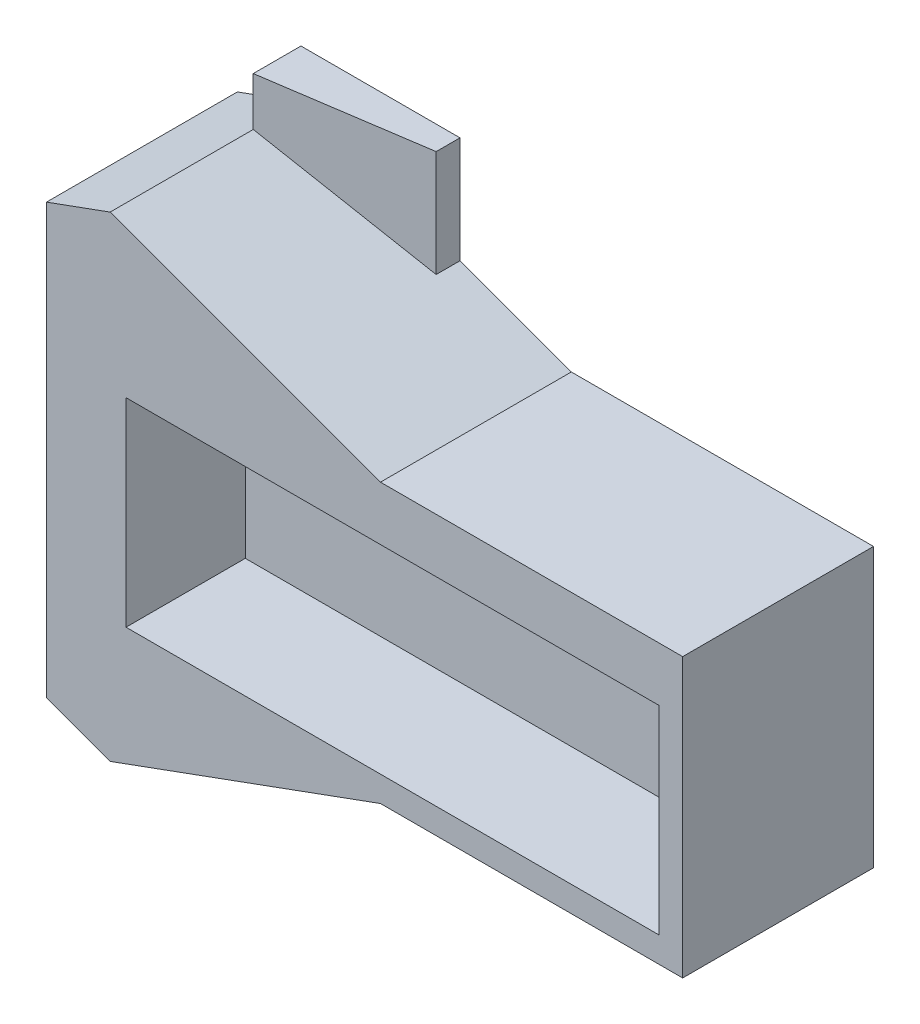
from build123d import *

# Parameters (mm, degrees)
BOSS_EXTRUDE1_DEPTH = 24
BOSS_EXTRUDE2_DEPTH = 36
SKETCH3_W           = 67
SKETCH3_H           = 25
CUT_EXTRUDE2_DEPTH  = 15


with BuildPart() as part:
    # Sketch1 → Boss-Extrude1 (new body)
    with BuildSketch(Plane.XY):
        Polygon((0, -27), (0, 27), (8, 29.911761874), (42, 17.5), (80, 17.5), (80, -17.5), (42, -17.5), (8, -29.911761874), align=None)
    extrude(amount=BOSS_EXTRUDE1_DEPTH)

    # Sketch2 → Boss-Extrude2 (add, symmetric)
    with BuildSketch(Plane(origin=(0, 0, 0), x_dir=(1, 0, 0), z_dir=(0, 1, 0))):
        Polygon((8, 0), (8, -6), (28, -3), (28, 0), align=None)
    extrude(amount=BOSS_EXTRUDE2_DEPTH, both=True)

    # Sketch3 → Cut-Extrude2 (cut)
    with BuildSketch(Plane.XY.offset(24)):
        with Locations((43.5, -1.797832718)):
            Rectangle(SKETCH3_W, SKETCH3_H)
    extrude(amount=-CUT_EXTRUDE2_DEPTH, mode=Mode.SUBTRACT)


solid = part.part
